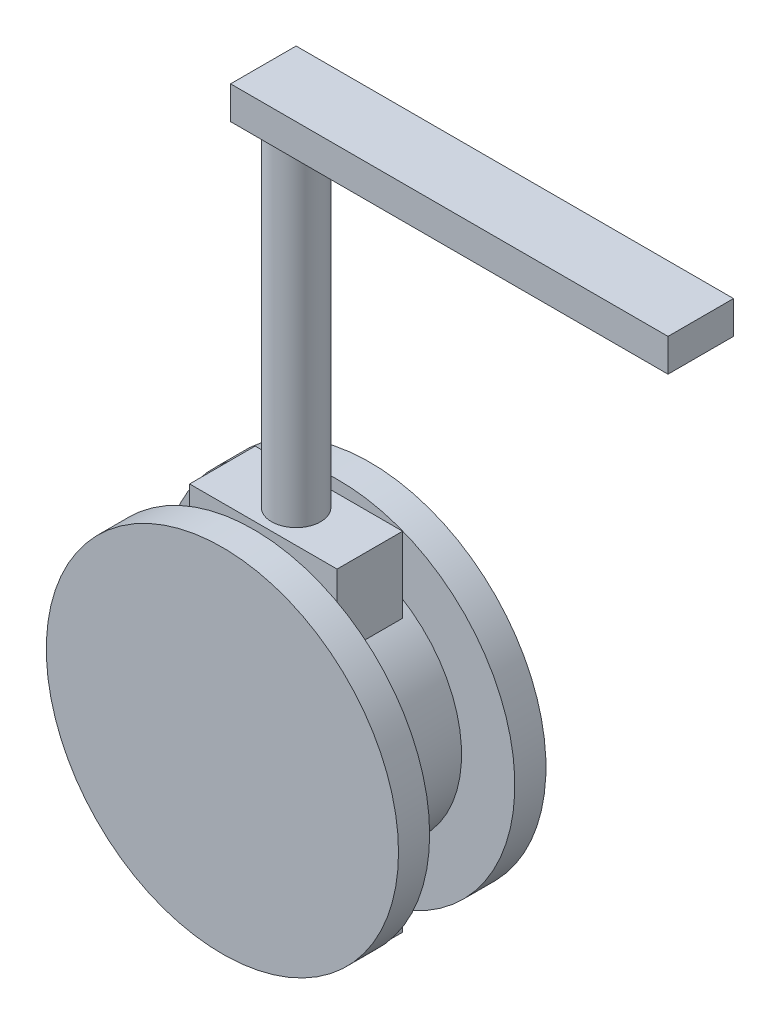
from build123d import *

# Parameters (mm, degrees)
SKETCH_1_R        = 75
EXTRUDE_296_DEPTH = 26
SKETCH_2_R        = 15
EXTRUDE_341_DEPTH = 330
SKETCH_3_W        = 267
SKETCH_3_H        = 40
EXTRUDE_488_DEPTH = 20
SKETCH_4_W        = 90
SKETCH_4_H        = 40
EXTRUDE_594_DEPTH = 106
SKETCH_5_R        = 107.5
EXTRUDE_1_DEPTH   = 19
EXTRUDE_START     = 19
SKETCH_6_R        = 107.5
EXTRUDE_2_DEPTH   = 19


with BuildPart() as part:
    # Эскиз1 → Extrude 296 (new, symmetric)
    with BuildSketch(Plane.XY):
        Circle(SKETCH_1_R)
    extrude(amount=EXTRUDE_296_DEPTH, both=True)

    # Эскиз2 → Extrude 341 (add)
    with BuildSketch(Plane(origin=(0, 0, 0), x_dir=(1, 0, 0), z_dir=(0, 1, 0))):
        Circle(SKETCH_2_R)
    extrude(amount=EXTRUDE_341_DEPTH)

    # Эскиз3 → Extrude 488 (add)
    with BuildSketch(Plane(origin=(0, 330, 0), x_dir=(-1, 0, 0), z_dir=(0, 1, 0))):
        with Locations((-113.5, 0)):
            Rectangle(SKETCH_3_W, SKETCH_3_H)
    extrude(amount=-EXTRUDE_488_DEPTH)

    # Эскиз4 → Extrude 594 (add, symmetric)
    with BuildSketch(Plane(origin=(0, 0, 0), x_dir=(1, 0, 0), z_dir=(0, 1, 0))):
        Rectangle(SKETCH_4_W, SKETCH_4_H)
    extrude(amount=EXTRUDE_594_DEPTH, both=True)

    # Эскиз5 → Фланец1 (add)
    with BuildSketch(Plane.XY.offset(26)):
        Circle(SKETCH_5_R)
    extrude(amount=EXTRUDE_1_DEPTH)

    # Эскиз6 → Фланец2 (add)
    with BuildSketch(Plane(origin=(0, 0, -26), x_dir=(-1, 0, 0), z_dir=(0, 0, -1)).offset(EXTRUDE_START)):
        Circle(SKETCH_6_R)
    extrude(amount=-EXTRUDE_2_DEPTH)


solid = part.part
